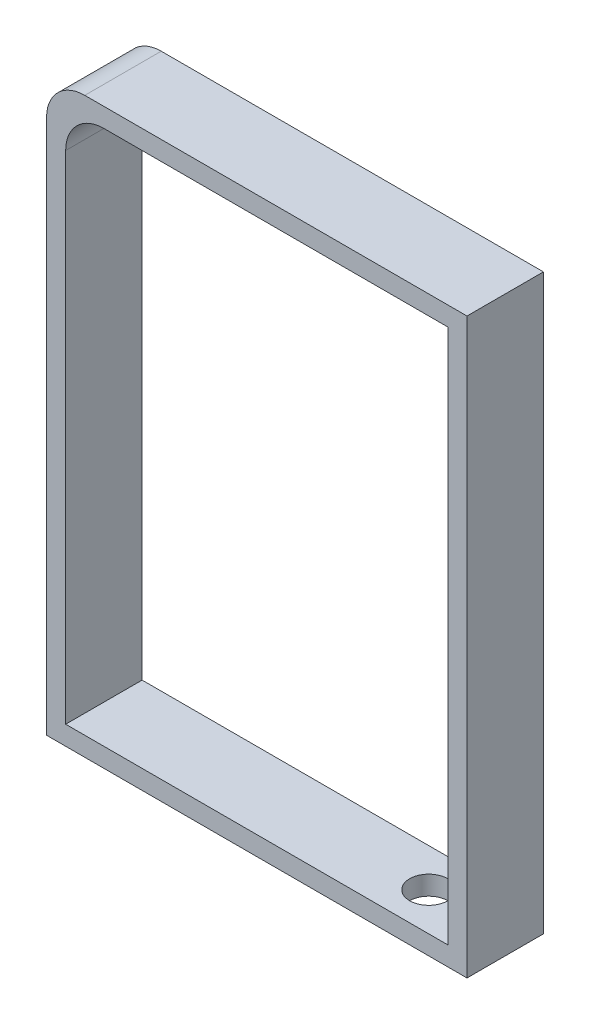
from build123d import *

# Parameters (mm, degrees)
SKETCH_1_W          = 55
SKETCH_1_H          = 75
EXTRUDE_1_DEPTH     = 10
SKETCH_3_W          = 50
SKETCH_3_H          = 70
CUT_EXTRUDE_1_DEPTH = 48.565743976
FILLET_2_R          = 5
SKETCH_4_R          = 2.5
CUT_EXTRUDE_2_DEPTH = 1.5
SKETCH_5_R          = 2.5
CUT_EXTRUDE_3_DEPTH = 79.182478856


with BuildPart() as part:
    # 草图1 → 凸台-拉伸1 (new body)
    with BuildSketch(Plane.XY):
        Rectangle(SKETCH_1_W, SKETCH_1_H)
    extrude(amount=EXTRUDE_1_DEPTH)

    # 草图3 → 切除-拉伸1 (cut, through all)
    with BuildSketch(Plane(origin=(0, 0, 0), x_dir=(-1, 0, 0), z_dir=(0, 0, -1))):
        Rectangle(SKETCH_3_W, SKETCH_3_H)
    extrude(amount=-CUT_EXTRUDE_1_DEPTH, mode=Mode.SUBTRACT)

    # 圆角2
    fillet_2_edges = [part.edges().sort_by_distance(p)[0] for p in [
        (-25, 35, 5),
        (-27.5, 37.5, 5),
    ]]
    fillet(fillet_2_edges, radius=FILLET_2_R)

    # 草图4 → 切除-拉伸2 (cut)
    with BuildSketch(Plane.XZ.offset(-35)):
        with Locations((17.5, 5)):
            Circle(SKETCH_4_R)
    extrude(amount=-CUT_EXTRUDE_2_DEPTH, mode=Mode.SUBTRACT)

    # 草图5 → 切除-拉伸3 (cut, through all)
    with BuildSketch(Plane(origin=(0, -35, 0), x_dir=(1, 0, 0), z_dir=(0, 1, 0))):
        with Locations((17.5, -5)):
            Circle(SKETCH_5_R)
    extrude(amount=-CUT_EXTRUDE_3_DEPTH, mode=Mode.SUBTRACT)


solid = part.part
